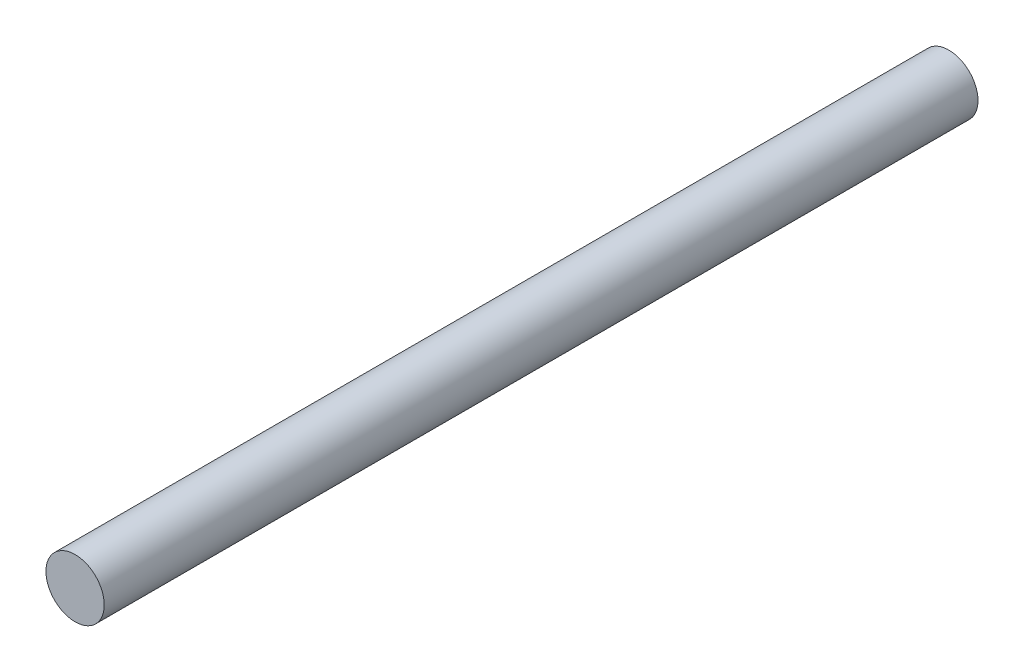
from build123d import *

# Parameters (mm, degrees)
SKETCH2_R           = 1.5875
BOSS_EXTRUDE1_DEPTH = 47.57


with BuildPart() as part:
    # Sketch2 → Boss-Extrude1 (new body)
    with BuildSketch(Plane.XY):
        Circle(SKETCH2_R)
    extrude(amount=BOSS_EXTRUDE1_DEPTH)


solid = part.part
